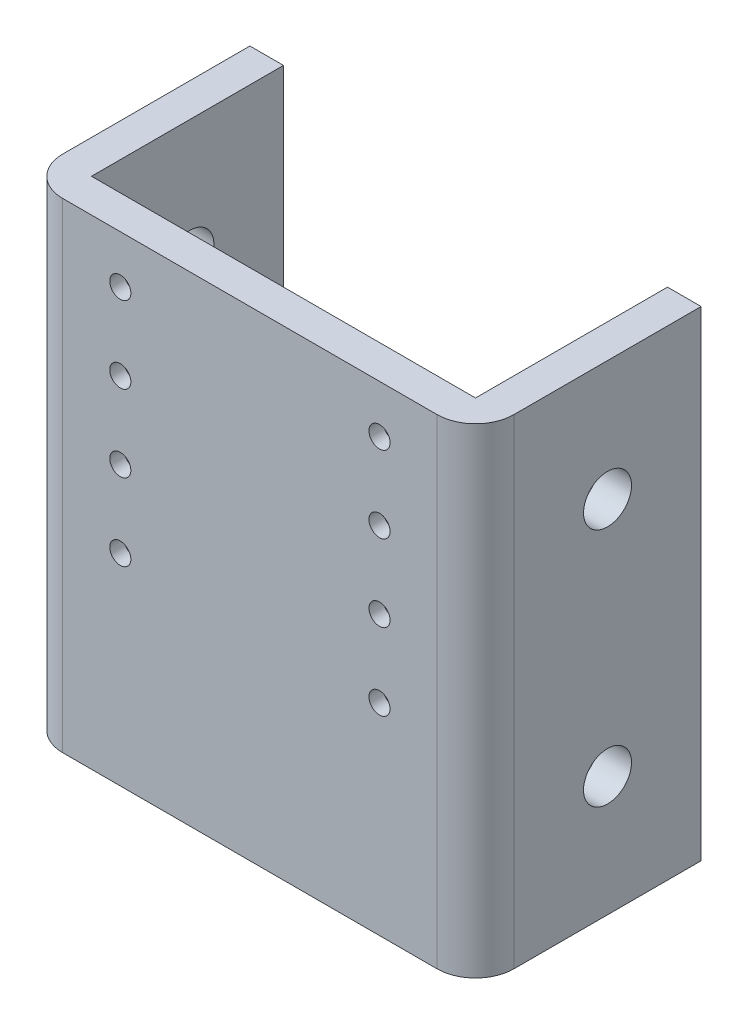
from build123d import *

# Parameters (mm, degrees)
CROQUIS1_W              = 36
CROQUIS1_H              = 50
SALIENTE_EXTRUIR1_DEPTH = 3.5
CROQUIS2_R              = 1.1
CORTAR_EXTRUIR2_DEPTH   = 5
CROQUIS5_W              = 3.5
CROQUIS5_H              = 20
CROQUIS5_W_2            = 5.5
CROQUIS5_H_2            = 3.5
SALIENTE_EXTRUIR3_DEPTH = 50
REDONDEO1_R             = 4
CROQUIS6_R              = 2.25
CORTAR_EXTRUIR3_DEPTH   = 2
CROQUIS8_R              = 2.5
CORTAR_EXTRUIR4_DEPTH   = 57.868268832


with BuildPart() as part:
    # Croquis1 → Saliente-Extruir1 (new body)
    with BuildSketch(Plane.XY):
        Rectangle(CROQUIS1_W, CROQUIS1_H)
    extrude(amount=SALIENTE_EXTRUIR1_DEPTH)

    # Croquis2 → Cortar-Extruir2 (cut)
    with BuildSketch(Plane.XY.offset(3.5)):
        with Locations((-13.5, 20)):
            Circle(CROQUIS2_R)
        with Locations((13.5, 20)):
            Circle(CROQUIS2_R)
        with Locations((13.5, 12)):
            Circle(CROQUIS2_R)
        with Locations((13.5, 4)):
            Circle(CROQUIS2_R)
        with Locations((13.5, -4)):
            Circle(CROQUIS2_R)
        with Locations((-13.5, 12)):
            Circle(CROQUIS2_R)
        with Locations((-13.5, 4)):
            Circle(CROQUIS2_R)
        with Locations((-13.5, -4)):
            Circle(CROQUIS2_R)
    extrude(amount=-CORTAR_EXTRUIR2_DEPTH, mode=Mode.SUBTRACT)

    # Croquis5 → Saliente-Extruir3 (add, through all)
    with BuildSketch(Plane(origin=(0, 25, 0), x_dir=(1, 0, 0), z_dir=(0, 1, 0))):
        Polygon((-18, 0), (-20, 0), (-23.5, 0), (-23.5, -3.5), (-18, -3.5), align=None)
        with Locations((-21.75, 10)):
            Rectangle(CROQUIS5_W, CROQUIS5_H)
        with Locations((20.75, -1.75)):
            Rectangle(CROQUIS5_W_2, CROQUIS5_H_2)
        with Locations((21.75, 10)):
            Rectangle(CROQUIS5_W, CROQUIS5_H)
    extrude(amount=-SALIENTE_EXTRUIR3_DEPTH)

    # Redondeo1
    redondeo1_edges = [part.edges().sort_by_distance(p)[0] for p in [
        (-23.5, 0, 3.5),
        (23.5, 0, 3.5),
    ]]
    fillet(redondeo1_edges, radius=REDONDEO1_R)

    # Croquis6 → Cortar-Extruir3 (cut)
    with BuildSketch(Plane(origin=(0, 0, 0), x_dir=(-1, 0, 0), z_dir=(0, 0, -1))):
        with Locations((-13.5, 20)):
            Circle(CROQUIS6_R)
        with Locations((13.5, 20)):
            Circle(CROQUIS6_R)
        with Locations((13.5, 12)):
            Circle(CROQUIS6_R)
        with Locations((13.5, 4)):
            Circle(CROQUIS6_R)
        with Locations((13.5, -4)):
            Circle(CROQUIS6_R)
        with Locations((-13.5, 12)):
            Circle(CROQUIS6_R)
        with Locations((-13.5, 4)):
            Circle(CROQUIS6_R)
        with Locations((-13.5, -4)):
            Circle(CROQUIS6_R)
    extrude(amount=-CORTAR_EXTRUIR3_DEPTH, mode=Mode.SUBTRACT)

    # Croquis8 → Cortar-Extruir4 (cut, through all)
    with BuildSketch(Plane(origin=(23.5, 0, 0), x_dir=(0, 0, -1), z_dir=(1, 0, 0))):
        with Locations((10.25, 12.5)):
            Circle(CROQUIS8_R)
        with Locations((10.25, -12.5)):
            Circle(CROQUIS8_R)
    extrude(amount=-CORTAR_EXTRUIR4_DEPTH, mode=Mode.SUBTRACT)


solid = part.part
